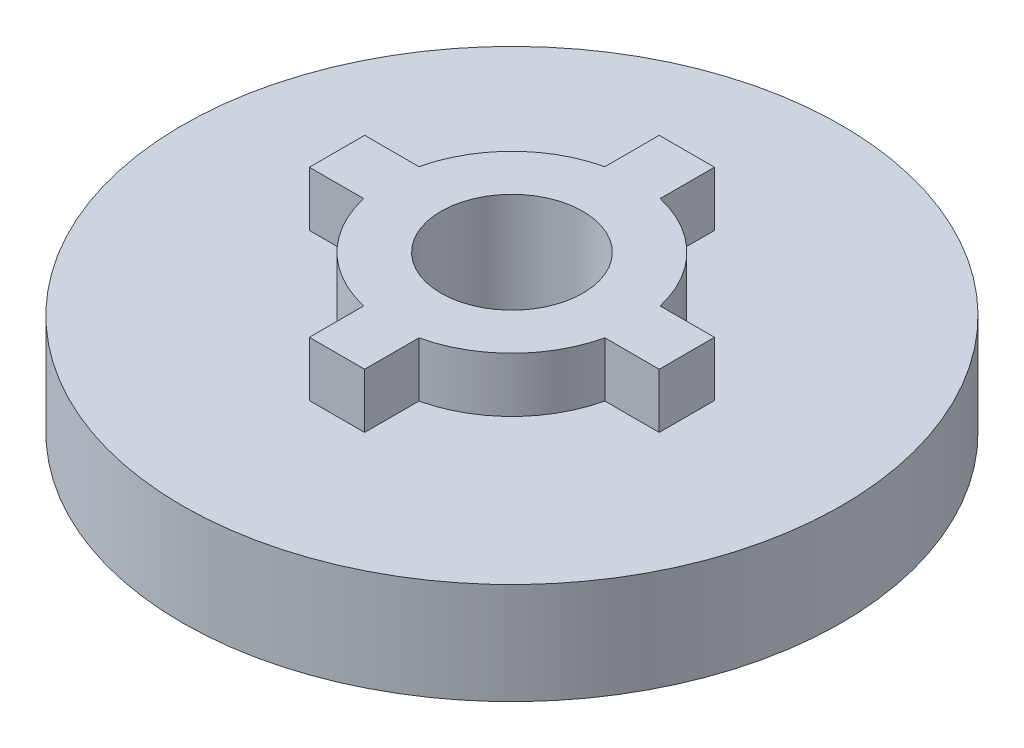
from build123d import *

# Parameters (mm, degrees)
SKETCH1_R           = 32.5
BOSS_EXTRUDE1_DEPTH = 10
BOSS_EXTRUDE2_DEPTH = 5.4
SKETCH3_R           = 7
CUT_EXTRUDE1_DEPTH  = 49.473291615


with BuildPart() as part:
    # Sketch1 → Boss-Extrude1 (new body)
    with BuildSketch(Plane(origin=(0, 0, 0), x_dir=(1, 0, 0), z_dir=(0, 1, 0))):
        with Locations(Location((0, 0, 0), (0, 0, 270))):
            Circle(SKETCH1_R)
    extrude(amount=BOSS_EXTRUDE1_DEPTH)

    # Sketch2 → Boss-Extrude2 (add)
    with BuildSketch(Plane(origin=(0, 10, 0), x_dir=(1, 0, 0), z_dir=(0, 1, 0))):
        with BuildLine():
            Line((2.725, 11.891777622), (2.725, 17.25))
            Line((2.725, 17.25), (-2.725, 17.25))
            Line((-2.725, 17.25), (-2.725, 11.891777622))
            ThreePointArc((-2.725, 11.891777622), (-8.62670273, 8.62670273), (-11.891777622, 2.725))
            Line((-11.891777622, 2.725), (-17.25, 2.725))
            Line((-17.25, 2.725), (-17.25, -2.725))
            Line((-17.25, -2.725), (-11.891777622, -2.725))
            ThreePointArc((-11.891777622, -2.725), (-8.62670273, -8.62670273), (-2.725, -11.891777622))
            Line((-2.725, -11.891777622), (-2.725, -17.25))
            Line((-2.725, -17.25), (2.725, -17.25))
            Line((2.725, -17.25), (2.725, -11.891777622))
            ThreePointArc((2.725, -11.891777622), (8.62670273, -8.62670273), (11.891777622, -2.725))
            Line((11.891777622, -2.725), (17.25, -2.725))
            Line((17.25, -2.725), (17.25, 2.725))
            Line((17.25, 2.725), (11.891777622, 2.725))
            ThreePointArc((11.891777622, 2.725), (8.62670273, 8.62670273), (2.725, 11.891777622))
        make_face()
    extrude(amount=BOSS_EXTRUDE2_DEPTH)

    # Sketch3 → Cut-Extrude1 (cut, through all)
    with BuildSketch(Plane(origin=(0, 15.4, 0), x_dir=(1, 0, 0), z_dir=(0, 1, 0))):
        with Locations(Location((0, 0, 0), (0, 0, 270))):
            Circle(SKETCH3_R)
    extrude(amount=-CUT_EXTRUDE1_DEPTH, mode=Mode.SUBTRACT)


solid = part.part
